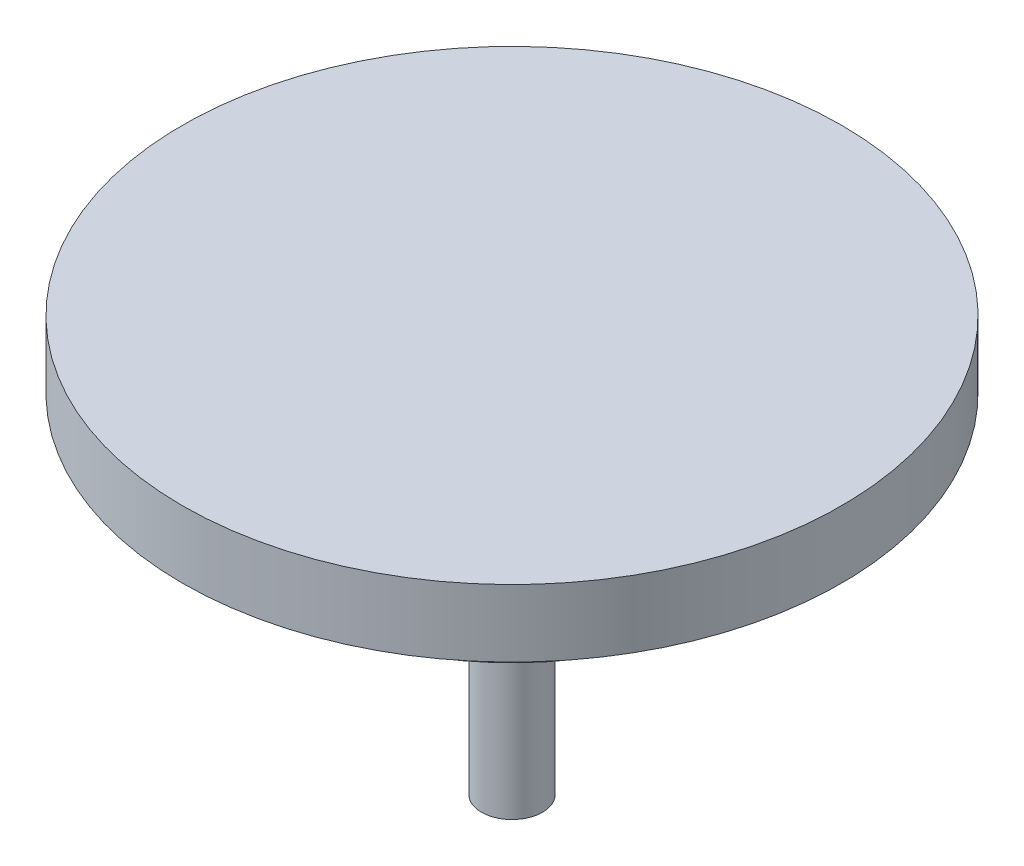
from build123d import *

# Parameters (mm, degrees)
SKETCH2_R           = 5
BOSS_EXTRUDE2_DEPTH = 57
SKETCH2_5_R         = 54
BOSS_EXTRUDE4_DEPTH = 11
SKETCH3_R           = 4
BOSS_EXTRUDE6_DEPTH = 10


with BuildPart() as part:
    # Sketch2 → Boss-Extrude2 (new body)
    with BuildSketch(Plane(origin=(0, 0, 0), x_dir=(1, 0, 0), z_dir=(0, 1, 0))):
        Circle(SKETCH2_R)
    extrude(amount=-BOSS_EXTRUDE2_DEPTH)

    # Sketch2<5> → Boss-Extrude4 (add)
    with BuildSketch(Plane(origin=(0, 0, 0), x_dir=(1, 0, 0), z_dir=(0, 1, 0))):
        Circle(SKETCH2_5_R)
    extrude(amount=BOSS_EXTRUDE4_DEPTH)

    # Sketch3 → Boss-Extrude6 (add)
    with BuildSketch(Plane.XZ):
        with Locations((-46, 19)):
            Circle(SKETCH3_R)
        with BuildLine():
            ThreePointArc((-28.565713714, -28), (36.878177829, -15.491933385), (0, 40))
            add(Edge.make_bspline(
                [(-28.565713714, -28), (-4.359091078, 1.635688794), (0, 40)],
                knots=[0, 0, 0, 1, 1, 1], degree=2))
        make_face()
    extrude(amount=BOSS_EXTRUDE6_DEPTH)


solid = part.part
